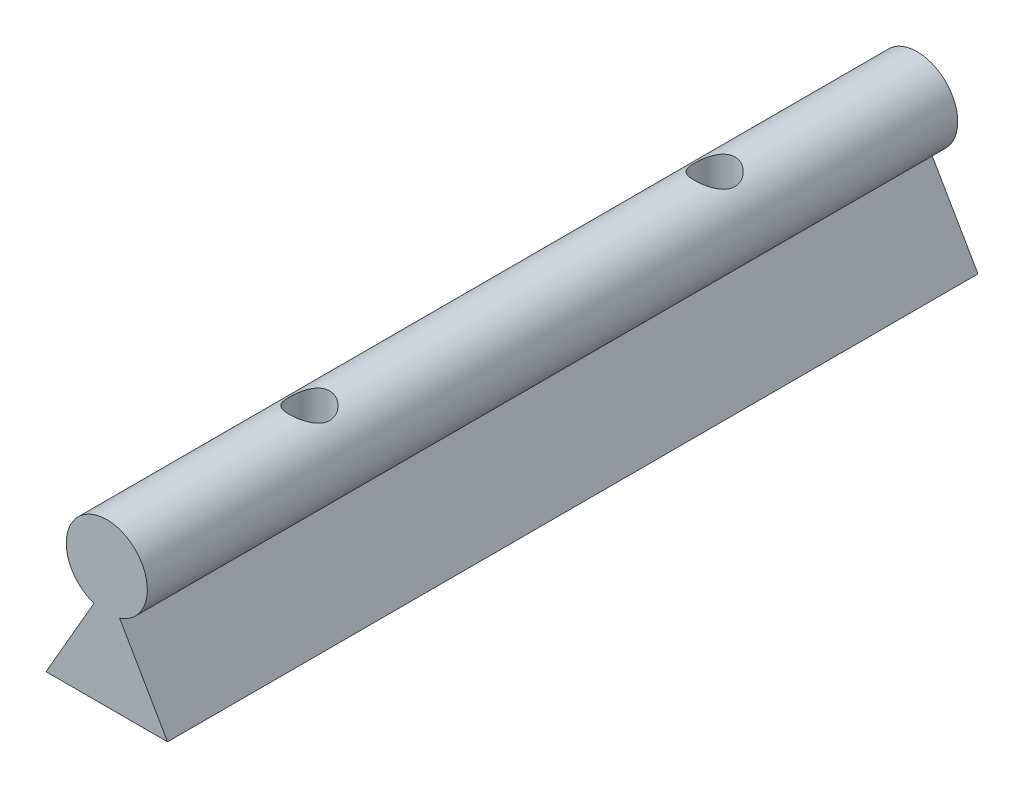
from build123d import *

# Parameters (mm, degrees)
BOSS_EXTRUDE1_DEPTH = 254
SKETCH2_R           = 3.3274
CUT_EXTRUDE1_DEPTH  = 260.72974897
SKETCH3_R           = 6.35
CUT_EXTRUDE2_DEPTH  = 12.7


with BuildPart() as part:
    # Sketch1 → Boss-Extrude1 (new body)
    with BuildSketch(Plane.XY):
        with BuildLine():
            Line((-19.05, 0), (19.05, 0))
            Line((19.05, 0), (4.010170085, 26.049749551))
            ThreePointArc((4.010170085, 26.049749551), (0, 50.8), (-4.010170085, 26.049749551))
            Line((-4.010170085, 26.049749551), (-19.05, 0))
        make_face()
    extrude(amount=BOSS_EXTRUDE1_DEPTH)

    # Sketch2 → Cut-Extrude1 (cut, through all)
    with BuildSketch(Plane.XZ):
        with Locations(Location((0, 190.5, 0), (0, 0, 270))):
            Circle(SKETCH2_R)
        with Locations(Location((0, 63.5, 0), (0, 0, 270))):
            Circle(SKETCH2_R)
    extrude(amount=-CUT_EXTRUDE1_DEPTH, mode=Mode.SUBTRACT)

    # Sketch3 → Cut-Extrude2 (cut)
    with BuildSketch(Plane(origin=(0, 50.8, 0), x_dir=(1, 0, 0), z_dir=(0, 1, 0))):
        with Locations(Location((0, -63.5, 0), (0, 0, 270))):
            Circle(SKETCH3_R)
        with Locations(Location((0, -190.5, 0), (0, 0, 270))):
            Circle(SKETCH3_R)
    extrude(amount=-CUT_EXTRUDE2_DEPTH, mode=Mode.SUBTRACT)


solid = part.part
